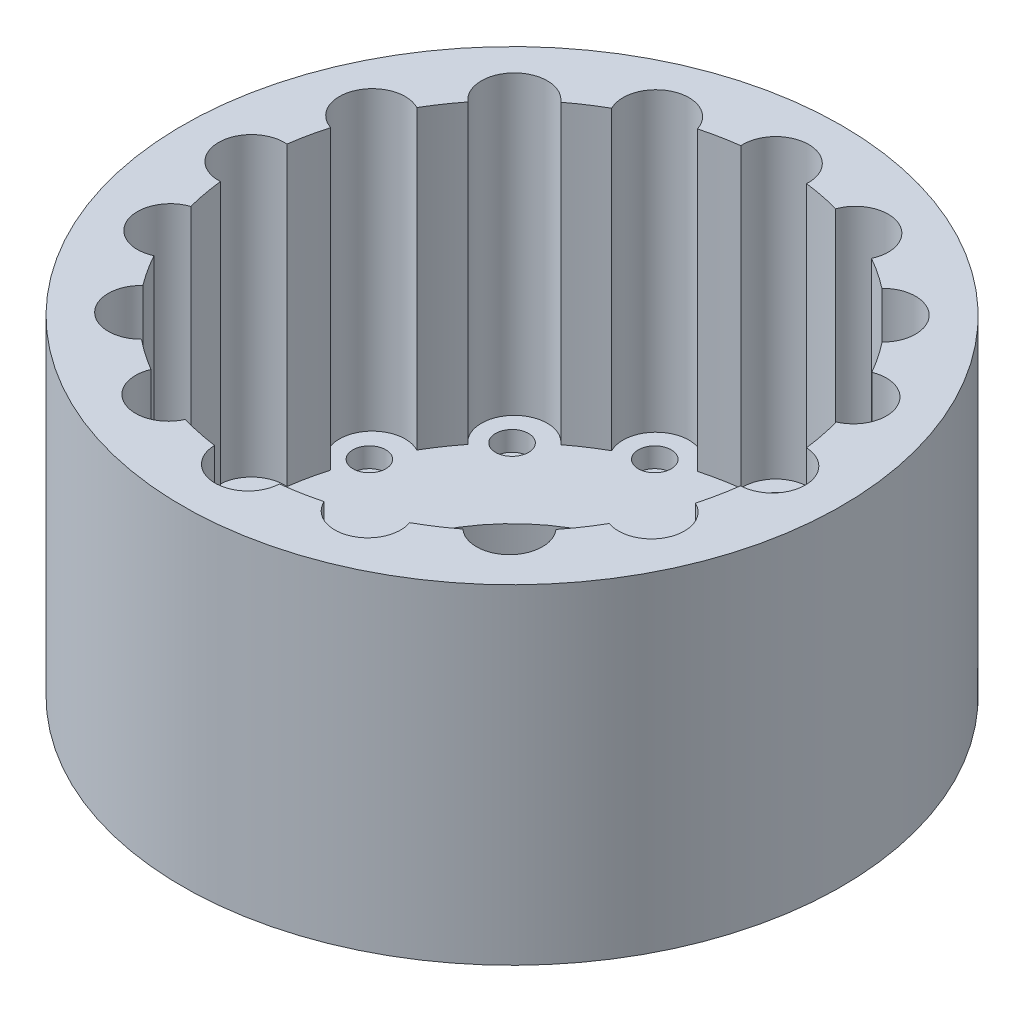
from build123d import *

# Parameters (mm, degrees)
SKETCH1_R           = 50
BOSS_EXTRUDE1_DEPTH = 45
BOSS_EXTRUDE2_START = 5
SKETCH2_R           = 50
BOSS_EXTRUDE2_DEPTH = 5
SKETCH3_R           = 2.5
CUT_EXTRUDE1_DEPTH  = 3
SKETCH4_R           = 25
CUT_EXTRUDE2_DEPTH  = 10


with BuildPart() as part:
    # Sketch1 → Boss-Extrude1 (new body)
    with BuildSketch(Plane(origin=(0, 0, 0), x_dir=(1, 0, 0), z_dir=(0, 1, 0))):
        with Locations(Location((0, 0, 0), (0, 0, 90))):
            Circle(SKETCH1_R)
        with BuildLine():
            ThreePointArc((-38.472091197, 10.949803601), (-39.142843019, 8.236373014), (-39.622464899, 5.482725176))
            ThreePointArc((-39.622464899, 5.482725176), (-45.027736203, 0.561560709), (-39.746875, -4.492875219))
            ThreePointArc((-39.746875, -4.492875219), (-39.333953887, -7.269117664), (-38.72736158, -10.009568673))
            ThreePointArc((-38.72736158, -10.009568673), (-41.748946282, -16.583911093), (-35.039748856, -19.292900251))
            ThreePointArc((-35.039748856, -19.292900251), (-33.590491244, -21.718169766), (-31.973653194, -24.035088963))
            ThreePointArc((-31.973653194, -24.035088963), (-32.157729031, -31.176050772), (-25.014492656, -31.213381059))
            ThreePointArc((-25.014492656, -31.213381059), (-22.728868069, -32.915020223), (-20.32789937, -34.449622744))
            ThreePointArc((-20.32789937, -34.449622744), (-17.707258167, -40.991172437), (-11.148020432, -38.415122549))
            ThreePointArc((-11.148020432, -38.415122549), (-8.358901204, -39.11686044), (-5.526568431, -39.6163734))
            ThreePointArc((-5.526568431, -39.6163734), (-0.59402965, -44.528471783), (4.46778962, -39.749702589))
            ThreePointArc((4.46778962, -39.749702589), (7.33562934, -39.321604013), (10.164921368, -38.686875986))
            ThreePointArc((10.164921368, -38.686875986), (16.574401115, -41.242300251), (19.433073291, -34.962203341))
            ThreePointArc((19.433073291, -34.962203341), (21.927230073, -33.454395546), (24.304976528, -31.768980405))
            ThreePointArc((24.304976528, -31.768980405), (31.177616874, -31.629495833), (31.415975195, -24.759573957))
            ThreePointArc((31.415975195, -24.759573957), (33.136656406, -22.404508524), (34.681152562, -19.930320042))
            ThreePointArc((34.681152562, -19.930320042), (40.985236081, -17.155873875), (38.537324177, -10.717959006))
            ThreePointArc((38.537324177, -10.717959006), (39.213686022, -7.892200491), (39.683137427, -5.024798895))
            ThreePointArc((39.683137427, -5.024798895), (44.500790375, -0.031685054), (39.690252613, 4.968284165))
            ThreePointArc((39.690252613, 4.968284165), (39.229069194, 7.815377799), (38.563928149, 10.62183815))
            ThreePointArc((38.563928149, 10.62183815), (41.191547229, 17.128956276), (34.724740733, 19.854278657))
            ThreePointArc((34.724740733, 19.854278657), (33.21843503, 22.283078202), (31.542548716, 24.598122296))
            ThreePointArc((31.542548716, 24.598122296), (31.568070741, 31.71029047), (24.456089141, 31.652799306))
            ThreePointArc((24.456089141, 31.652799306), (22.154728904, 33.304173721), (19.742272443, 34.788542349))
            ThreePointArc((19.742272443, 34.788542349), (17.102427339, 41.494962196), (10.503764758, 38.596255335))
            ThreePointArc((10.503764758, 38.596255335), (7.766185163, 39.238837496), (4.99022482, 39.6875))
            ThreePointArc((4.99022482, 39.6875), (0, 45), (-4.99022482, 39.6875))
            ThreePointArc((-4.99022482, 39.6875), (-7.752560801, 39.241531584), (-10.476960655, 38.603539934))
            ThreePointArc((-10.476960655, 38.603539934), (-17.137978748, 41.698652845), (-19.697351689, 34.813996272))
            ThreePointArc((-19.697351689, 34.813996272), (-22.077028029, 33.355731643), (-24.349225183, 31.735078903))
            ThreePointArc((-24.349225183, 31.735078903), (-31.708929174, 32.096652706), (-31.436823309, 24.733098071))
            ThreePointArc((-31.436823309, 24.733098071), (-33.084428294, 22.481561432), (-34.571077134, 20.120651724))
            ThreePointArc((-34.571077134, 20.120651724), (-41.501374638, 17.653486782), (-38.472091197, 10.949803601))
        make_face(mode=Mode.SUBTRACT)
    extrude(amount=BOSS_EXTRUDE1_DEPTH)

    # Sketch2 → Boss-Extrude2 (add)
    with BuildSketch(Plane.XZ.offset(BOSS_EXTRUDE2_START)):
        with Locations(Location((0, 0, 0), (0, 0, 270))):
            Circle(SKETCH2_R)
    extrude(amount=-BOSS_EXTRUDE2_DEPTH)

    # Sketch3 → Cut-Extrude1 (cut)
    with BuildSketch(Plane(origin=(0, 0, 0), x_dir=(1, 0, 0), z_dir=(0, 1, 0))):
        with Locations(Location((0, 40, 0), (0, 0, 270))):
            Circle(SKETCH3_R)
        with Locations(Location((15.307337295, 36.9551813, 0), (0, 0, 270))):
            Circle(SKETCH3_R)
        with Locations(Location((28.284271247, 28.284271247, 0), (0, 0, 270))):
            Circle(SKETCH3_R)
        with Locations(Location((36.9551813, 15.307337295, 0), (0, 0, 270))):
            Circle(SKETCH3_R)
        with Locations(Location((40, 0, 0), (0, 0, 270))):
            Circle(SKETCH3_R)
        with Locations(Location((36.9551813, -15.307337295, 0), (0, 0, 270))):
            Circle(SKETCH3_R)
        with Locations(Location((28.284271247, -28.284271247, 0), (0, 0, 270))):
            Circle(SKETCH3_R)
        with Locations(Location((15.307337295, -36.9551813, 0), (0, 0, 270))):
            Circle(SKETCH3_R)
        with Locations(Location((0, -40, 0), (0, 0, 270))):
            Circle(SKETCH3_R)
        with Locations(Location((-15.307337295, -36.9551813, 0), (0, 0, 270))):
            Circle(SKETCH3_R)
        with Locations(Location((-28.284271247, -28.284271247, 0), (0, 0, 270))):
            Circle(SKETCH3_R)
        with Locations(Location((-36.9551813, -15.307337295, 0), (0, 0, 270))):
            Circle(SKETCH3_R)
        with Locations(Location((-40, 0, 0), (0, 0, 270))):
            Circle(SKETCH3_R)
        with Locations(Location((-36.9551813, 15.307337295, 0), (0, 0, 270))):
            Circle(SKETCH3_R)
        with Locations(Location((-28.284271247, 28.284271247, 0), (0, 0, 270))):
            Circle(SKETCH3_R)
        with Locations(Location((-15.307337295, 36.9551813, 0), (0, 0, 270))):
            Circle(SKETCH3_R)
    extrude(amount=-CUT_EXTRUDE1_DEPTH, mode=Mode.SUBTRACT)

    # Sketch4 → Cut-Extrude2 (cut)
    with BuildSketch(Plane(origin=(0, 0, 0), x_dir=(1, 0, 0), z_dir=(0, 1, 0))):
        with Locations(Location((0, 0, 0), (0, 0, 270))):
            Circle(SKETCH4_R)
    extrude(amount=-CUT_EXTRUDE2_DEPTH, mode=Mode.SUBTRACT)


solid = part.part
